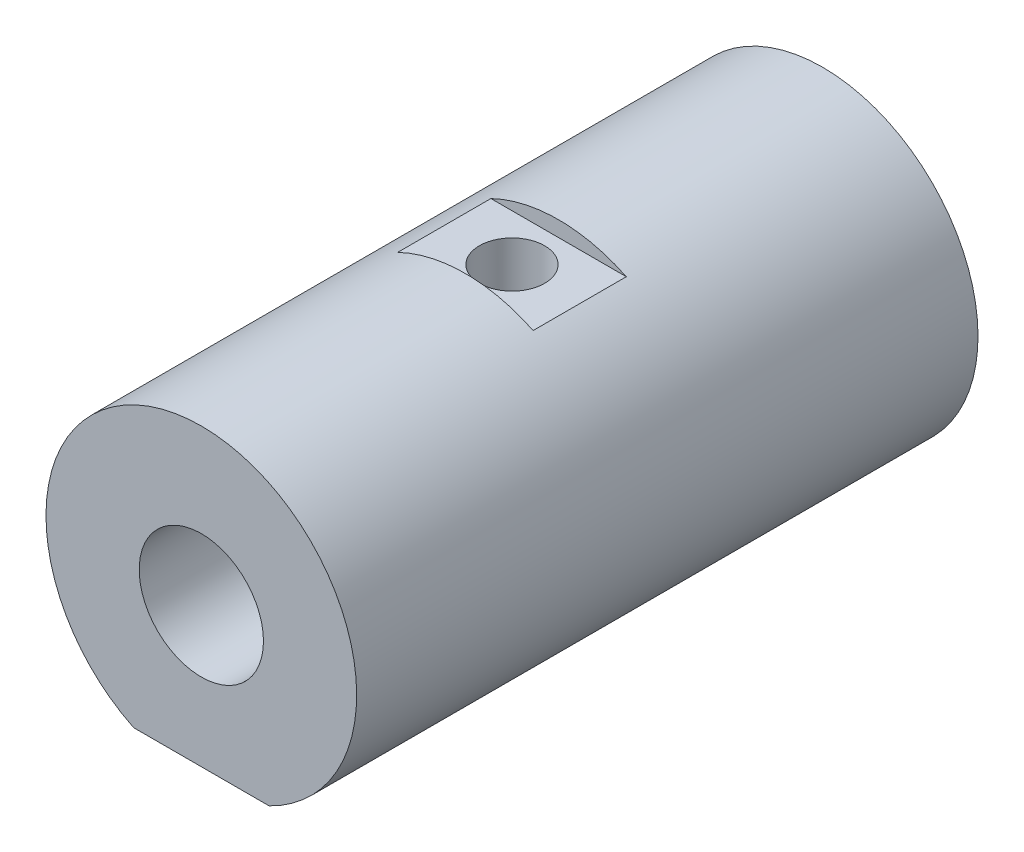
from build123d import *

# Parameters (mm, degrees)
SKETCH1_R                           = 10
SKETCH1_R_2                         = 4
BOSS_EXTRUDE1_DEPTH                 = 40
SKETCH4_W                           = 2.1
SKETCH4_H                           = 10
CUT_EXTRUDE1_START                  = 10
SKETCH5_W                           = 20
SKETCH5_H                           = 6
CUT_EXTRUDE1_DEPTH                  = 1
SKETCH7_W                           = 2.1
SKETCH7_H                           = 10
F_4_2_4_2_DIAMETER_HOLE1_AT_2_COUNT = 2
F_4_2_4_2_DIAMETER_HOLE1_AT_2_PITCH = 10
F_4_2_4_2_DIAMETER_HOLE1_AT_3_COUNT = 2
F_4_2_4_2_DIAMETER_HOLE1_AT_3_PITCH = 20
CUT_EXTRUDE3_START                  = -10
SKETCH8_W                           = 20
SKETCH8_H                           = 40
CUT_EXTRUDE3_DEPTH                  = 1


with BuildPart() as part:
    # Sketch1 → Boss-Extrude1 (new body)
    with BuildSketch(Plane.XY):
        Circle(SKETCH1_R)
        Circle(SKETCH1_R_2, mode=Mode.SUBTRACT)
    extrude(amount=BOSS_EXTRUDE1_DEPTH)

    # Sketch4 → Ø4.2 (4.2) Diameter Hole2 (revolve, cut)
    with BuildSketch(Plane(origin=(0, 0, 20), x_dir=(0, 0, -1), z_dir=(1, 0, 0))):
        with Locations((1.05, 5)):
            Rectangle(SKETCH4_W, SKETCH4_H)
    revolve(axis=Axis((0, -6.35, 20), (0, 1, 0)), mode=Mode.SUBTRACT)

    # Sketch5 → Cut-Extrude1 (cut)
    with BuildSketch(Plane(origin=(0, 0, 0), x_dir=(1, 0, 0), z_dir=(0, 1, 0)).offset(CUT_EXTRUDE1_START)):
        with Locations((0, -20)):
            Rectangle(SKETCH5_W, SKETCH5_H)
    extrude(amount=-CUT_EXTRUDE1_DEPTH, mode=Mode.SUBTRACT)

    # Sketch7 → Ø4.2 (4.2) Diameter Hole1 (revolve, cut)
    with BuildSketch(Plane(origin=(0, 0, 30), x_dir=(0, 0, 1), z_dir=(1, 0, 0))):
        with Locations((1.05, 5)):
            Rectangle(SKETCH7_W, SKETCH7_H)
    f_4_2_4_2_diameter_hole1 = revolve(axis=Axis((0, 6.35, 30), (0, -1, 0)), mode=Mode.SUBTRACT)

    # Ø4.2 (4.2) Diameter Hole1 at 2: Ø4.2 (4.2) Diameter Hole1 ×2
    with Locations(*[(0, 0, -i * F_4_2_4_2_DIAMETER_HOLE1_AT_2_PITCH) for i in range(1, F_4_2_4_2_DIAMETER_HOLE1_AT_2_COUNT)]):
        add(f_4_2_4_2_diameter_hole1, mode=Mode.SUBTRACT)

    # Ø4.2 (4.2) Diameter Hole1 at 3: Ø4.2 (4.2) Diameter Hole1 ×2
    with Locations(*[(0, 0, -i * F_4_2_4_2_DIAMETER_HOLE1_AT_3_PITCH) for i in range(1, F_4_2_4_2_DIAMETER_HOLE1_AT_3_COUNT)]):
        add(f_4_2_4_2_diameter_hole1, mode=Mode.SUBTRACT)

    # Sketch8 → Cut-Extrude3 (cut)
    with BuildSketch(Plane(origin=(0, 0, 0), x_dir=(1, 0, 0), z_dir=(0, 1, 0)).offset(CUT_EXTRUDE3_START)):
        with Locations((0, -20)):
            Rectangle(SKETCH8_W, SKETCH8_H)
    extrude(amount=CUT_EXTRUDE3_DEPTH, mode=Mode.SUBTRACT)


solid = part.part
